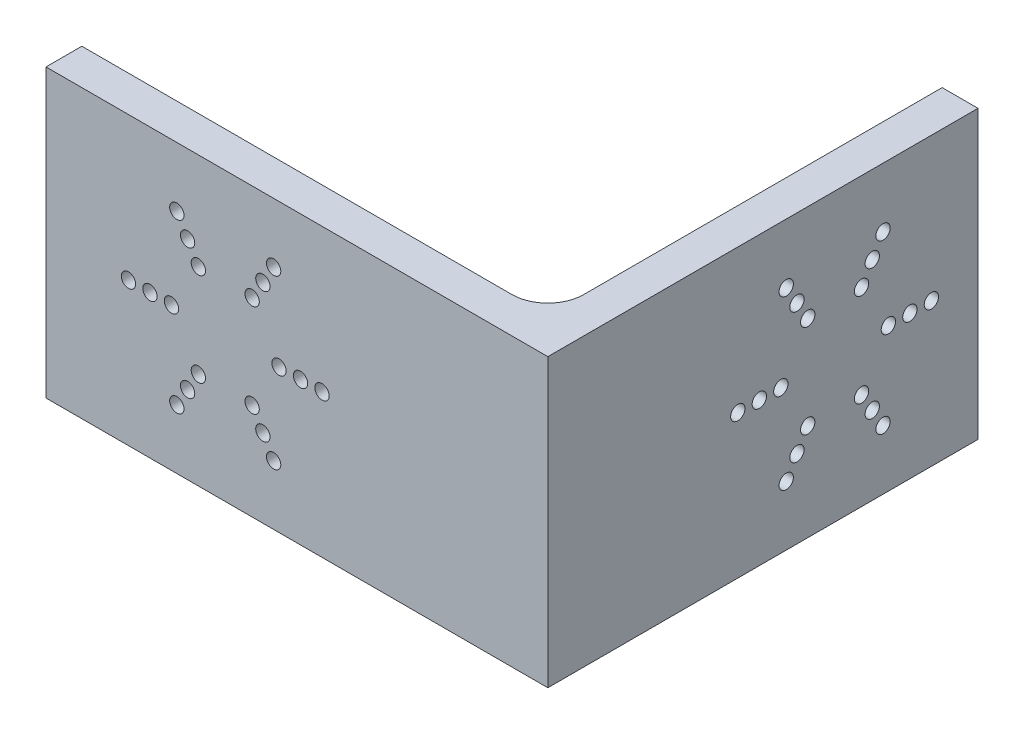
from build123d import *

# Parameters (mm, degrees)
SKETCH1_W           = 70
SKETCH1_H           = 60
BOSS_EXTRUDE1_DEPTH = 20
SKETCH2_W           = 65
SKETCH2_H           = 55
CUT_EXTRUDE1_DEPTH  = 40
FILLET1_R           = 5
SKETCH3_R           = 1
CUT_EXTRUDE2_DEPTH  = 5
SKETCH4_R           = 1
CUT_EXTRUDE3_DEPTH  = 5


with BuildPart() as part:
    # Sketch1 → Boss-Extrude1 (new, symmetric)
    with BuildSketch(Plane(origin=(0, 0, 0), x_dir=(1, 0, 0), z_dir=(0, 1, 0))):
        Rectangle(SKETCH1_W, SKETCH1_H)
    extrude(amount=BOSS_EXTRUDE1_DEPTH, both=True)

    # Sketch2 → Cut-Extrude1 (cut)
    with BuildSketch(Plane(origin=(0, 20, 0), x_dir=(1, 0, 0), z_dir=(0, 1, 0))):
        with Locations((-2.5, 2.5)):
            Rectangle(SKETCH2_W, SKETCH2_H)
    extrude(amount=-CUT_EXTRUDE1_DEPTH, mode=Mode.SUBTRACT)

    # Fillet1
    fillet1_edges = [part.edges().sort_by_distance(p)[0] for p in [
        (30, 0, 25),
    ]]
    fillet(fillet1_edges, radius=FILLET1_R)

    # Sketch3 → Cut-Extrude2 (cut)
    with BuildSketch(Plane.XY.offset(30)):
        with Locations((-2.5, 0)):
            Circle(SKETCH3_R)
        with Locations((0.5, 0)):
            Circle(SKETCH3_R)
        with Locations((3.5, 0)):
            Circle(SKETCH3_R)
        with Locations((-6.25, -6.495190528)):
            Circle(SKETCH3_R)
        with Locations((-4.75, -9.09326674)):
            Circle(SKETCH3_R)
        with Locations((-3.25, -11.691342951)):
            Circle(SKETCH3_R)
        with Locations((-13.75, -6.495190528)):
            Circle(SKETCH3_R)
        with Locations((-15.25, -9.09326674)):
            Circle(SKETCH3_R)
        with Locations((-16.75, -11.691342951)):
            Circle(SKETCH3_R)
        with Locations((-17.5, 0)):
            Circle(SKETCH3_R)
        with Locations((-20.5, 0)):
            Circle(SKETCH3_R)
        with Locations((-23.5, 0)):
            Circle(SKETCH3_R)
        with Locations((-13.75, 6.495190528)):
            Circle(SKETCH3_R)
        with Locations((-15.25, 9.09326674)):
            Circle(SKETCH3_R)
        with Locations((-16.75, 11.691342951)):
            Circle(SKETCH3_R)
        with Locations((-6.25, 6.495190528)):
            Circle(SKETCH3_R)
        with Locations((-4.75, 9.09326674)):
            Circle(SKETCH3_R)
        with Locations((-3.25, 11.691342951)):
            Circle(SKETCH3_R)
    extrude(amount=-CUT_EXTRUDE2_DEPTH, mode=Mode.SUBTRACT)

    # Sketch4 → Cut-Extrude3 (cut)
    with BuildSketch(Plane(origin=(35, 0, 0), x_dir=(0, 0, -1), z_dir=(1, 0, 0))):
        with Locations((17.5, 0)):
            Circle(SKETCH4_R)
        with Locations((20.5, 0)):
            Circle(SKETCH4_R)
        with Locations((23.5, 0)):
            Circle(SKETCH4_R)
        with Locations((13.75, -6.495190528)):
            Circle(SKETCH4_R)
        with Locations((15.25, -9.09326674)):
            Circle(SKETCH4_R)
        with Locations((16.75, -11.691342951)):
            Circle(SKETCH4_R)
        with Locations((6.25, -6.495190528)):
            Circle(SKETCH4_R)
        with Locations((4.75, -9.09326674)):
            Circle(SKETCH4_R)
        with Locations((3.25, -11.691342951)):
            Circle(SKETCH4_R)
        with Locations((2.5, 0)):
            Circle(SKETCH4_R)
        with Locations((-0.5, 0)):
            Circle(SKETCH4_R)
        with Locations((-3.5, 0)):
            Circle(SKETCH4_R)
        with Locations((6.25, 6.495190528)):
            Circle(SKETCH4_R)
        with Locations((4.75, 9.09326674)):
            Circle(SKETCH4_R)
        with Locations((3.25, 11.691342951)):
            Circle(SKETCH4_R)
        with Locations((13.75, 6.495190528)):
            Circle(SKETCH4_R)
        with Locations((15.25, 9.09326674)):
            Circle(SKETCH4_R)
        with Locations((16.75, 11.691342951)):
            Circle(SKETCH4_R)
    extrude(amount=-CUT_EXTRUDE3_DEPTH, mode=Mode.SUBTRACT)


solid = part.part
